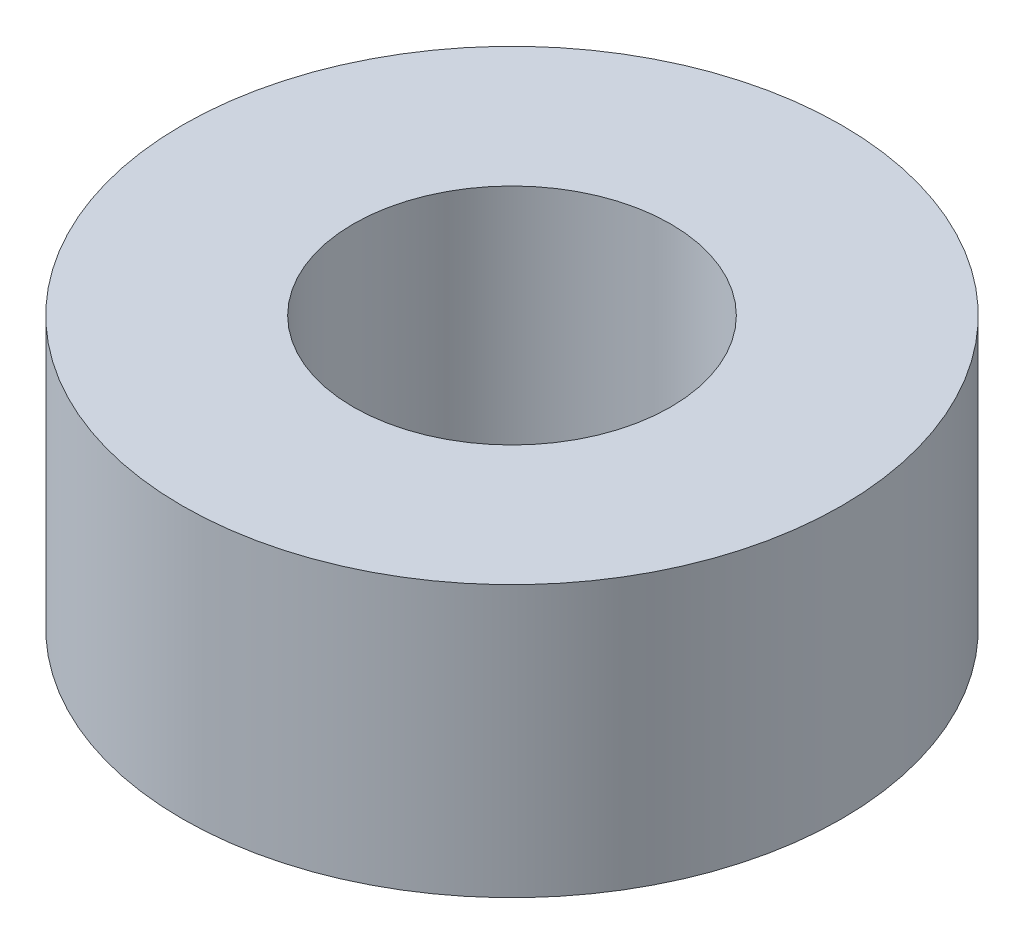
from build123d import *

# Parameters (mm, degrees)
SKETCH1_R           = 5.715
SKETCH1_R_2         = 2.75
BOSS_EXTRUDE1_DEPTH = 4.699


with BuildPart() as part:
    # Sketch1 → Boss-Extrude1 (new body)
    with BuildSketch(Plane(origin=(0, 0, 0), x_dir=(1, 0, 0), z_dir=(0, 1, 0))):
        with Locations(Location((0, 0, 0), (0, 0, 270))):
            Circle(SKETCH1_R)
        with Locations(Location((0, 0, 0), (0, 0, 270))):
            Circle(SKETCH1_R_2, mode=Mode.SUBTRACT)
    extrude(amount=BOSS_EXTRUDE1_DEPTH)


solid = part.part
